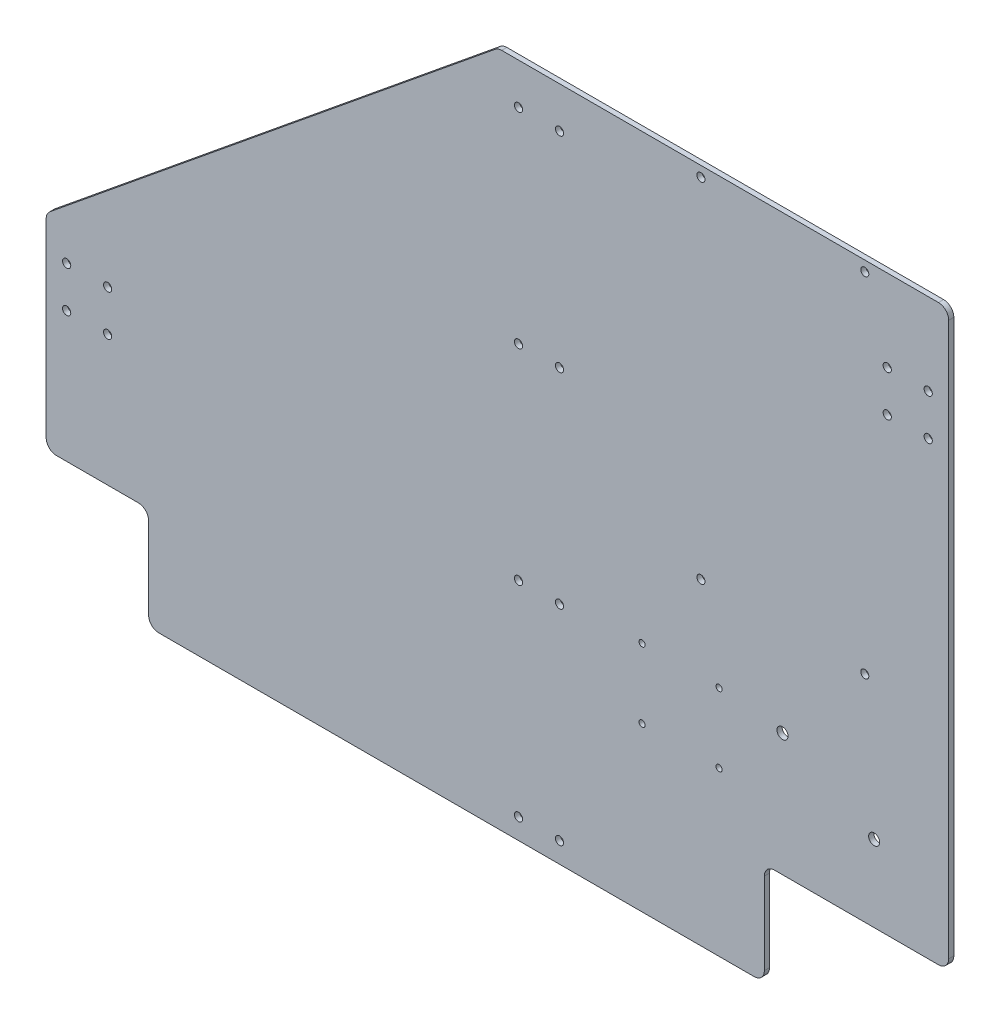
from build123d import *

# Parameters (mm, degrees)
SKETCH1_R           = 2.54
SKETCH1_W           = 50.8
SKETCH1_H           = 355.6
BOSS_EXTRUDE1_DEPTH = 3.175
FILLET1_R           = 6.35
SKETCH6_R           = 2.5
SKETCH6_R_2         = 3.429
SKETCH6_R_3         = 1.905
CUT_EXTRUDE6_DEPTH  = 5.08


with BuildPart() as part:
    # Sketch1 → Boss-Extrude1 (new body)
    # profile 1 of 2: a face of its own
    with BuildSketch(Plane.XY):
        Polygon((0, 190.5), (0, 63.5), (63.5, 63.5), (63.5, 0), (445.262, 0), (445.262, 63.5), (508.762, 63.5), (508.762, 419.1), (280.162, 419.1), align=None)
        with Locations((12.7, 144.4625)):
            Circle(SKETCH1_R, mode=Mode.SUBTRACT)
        with Locations((38.1, 144.4625)):
            Circle(SKETCH1_R, mode=Mode.SUBTRACT)
        with Locations((12.7, 169.8625)):
            Circle(SKETCH1_R, mode=Mode.SUBTRACT)
        with Locations((38.1, 169.8625)):
            Circle(SKETCH1_R, mode=Mode.SUBTRACT)
        with Locations((292.862, 12.7)):
            Circle(SKETCH1_R, mode=Mode.SUBTRACT)
        with Locations((318.262, 12.7)):
            Circle(SKETCH1_R, mode=Mode.SUBTRACT)
        with Locations((292.862, 139.7)):
            Circle(SKETCH1_R, mode=Mode.SUBTRACT)
        with Locations((318.262, 139.7)):
            Circle(SKETCH1_R, mode=Mode.SUBTRACT)
        with Locations((292.862, 266.7)):
            Circle(SKETCH1_R, mode=Mode.SUBTRACT)
        with Locations((318.262, 266.7)):
            Circle(SKETCH1_R, mode=Mode.SUBTRACT)
        with Locations((292.862, 393.7)):
            Circle(SKETCH1_R, mode=Mode.SUBTRACT)
        with Locations((318.262, 393.7)):
            Circle(SKETCH1_R, mode=Mode.SUBTRACT)
    # profile 2 of 2: a face of its own
    with BuildSketch(Plane.XY):
        with Locations((534.162, 241.3)):
            Rectangle(SKETCH1_W, SKETCH1_H)
        with Locations((521.462, 342.9)):
            Circle(SKETCH1_R, mode=Mode.SUBTRACT)
        with Locations((546.862, 342.9)):
            Circle(SKETCH1_R, mode=Mode.SUBTRACT)
        with Locations((521.462, 368.3)):
            Circle(SKETCH1_R, mode=Mode.SUBTRACT)
        with Locations((546.862, 368.3)):
            Circle(SKETCH1_R, mode=Mode.SUBTRACT)
    extrude(amount=BOSS_EXTRUDE1_DEPTH)

    # Fillet1
    fillet1_edges = [part.edges().sort_by_distance(p)[0] for p in [
        (280.162, 419.1, 1.5875),
        (559.562, 419.1, 1.5875),
        (559.562, 63.5, 1.5875),
        (445.262, 63.5, 1.5875),
        (445.262, 0, 1.5875),
        (63.5, 0, 1.5875),
        (63.5, 63.5, 1.5875),
        (0, 63.5, 1.5875),
        (0, 190.5, 1.5875),
    ]]
    fillet(fillet1_edges, radius=FILLET1_R)

    # Sketch6 → Cut-Extrude6 (cut)
    with BuildSketch(Plane(origin=(0, 0, 0), x_dir=(-1, 0, 0), z_dir=(0, 0, -1))):
        with Locations((-507.534100105, 412.722244751)):
            Circle(SKETCH6_R)
        with Locations((-405.934100105, 412.722244751)):
            Circle(SKETCH6_R)
        with Locations((-507.534100105, 196.822244751)):
            Circle(SKETCH6_R)
        with Locations((-513.362102572, 110.957488219)):
            Circle(SKETCH6_R_2)
        with Locations((-456.524599675, 139.527828861)):
            Circle(SKETCH6_R_2)
        with Locations((-405.934100105, 196.822244751)):
            Circle(SKETCH6_R)
        with Locations((-417.19502212, 144.189284242)):
            Circle(SKETCH6_R_3)
        with Locations((-369.44302212, 144.189284242)):
            Circle(SKETCH6_R_3)
        with Locations((-417.192668653, 101.136284242)):
            Circle(SKETCH6_R_3)
        with Locations((-369.44302212, 101.136284242)):
            Circle(SKETCH6_R_3)
    extrude(amount=-CUT_EXTRUDE6_DEPTH, mode=Mode.SUBTRACT)


solid = part.part
